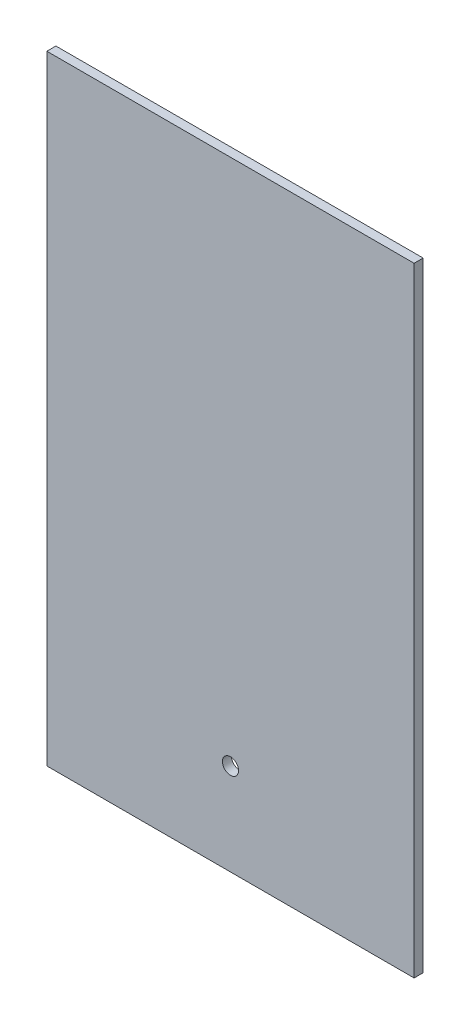
from build123d import *

# Parameters (mm, degrees)
ESBO_O1_W                = 191.8
ESBO_O1_H                = 113.8
RESSALTO_EXTRUS_O1_DEPTH = 1.4
ESBO_O2_R                = 2.5
CORTE_EXTRUS_O1_DEPTH    = 2.8


with BuildPart() as part:
    # Esboço1 → Ressalto-extrusão1 (new, symmetric)
    with BuildSketch(Plane(origin=(0, 0, 0), x_dir=(0, 1, 0), z_dir=(0, 0, 1))):
        Rectangle(ESBO_O1_W, ESBO_O1_H)
    extrude(amount=RESSALTO_EXTRUS_O1_DEPTH, both=True)

    # Esboço2 → Corte-extrusão1 (cut)
    with BuildSketch(Plane.XY.offset(1.4)):
        with Locations((0, -67.468129393)):
            Circle(ESBO_O2_R)
    extrude(amount=-CORTE_EXTRUS_O1_DEPTH, mode=Mode.SUBTRACT)


solid = part.part
